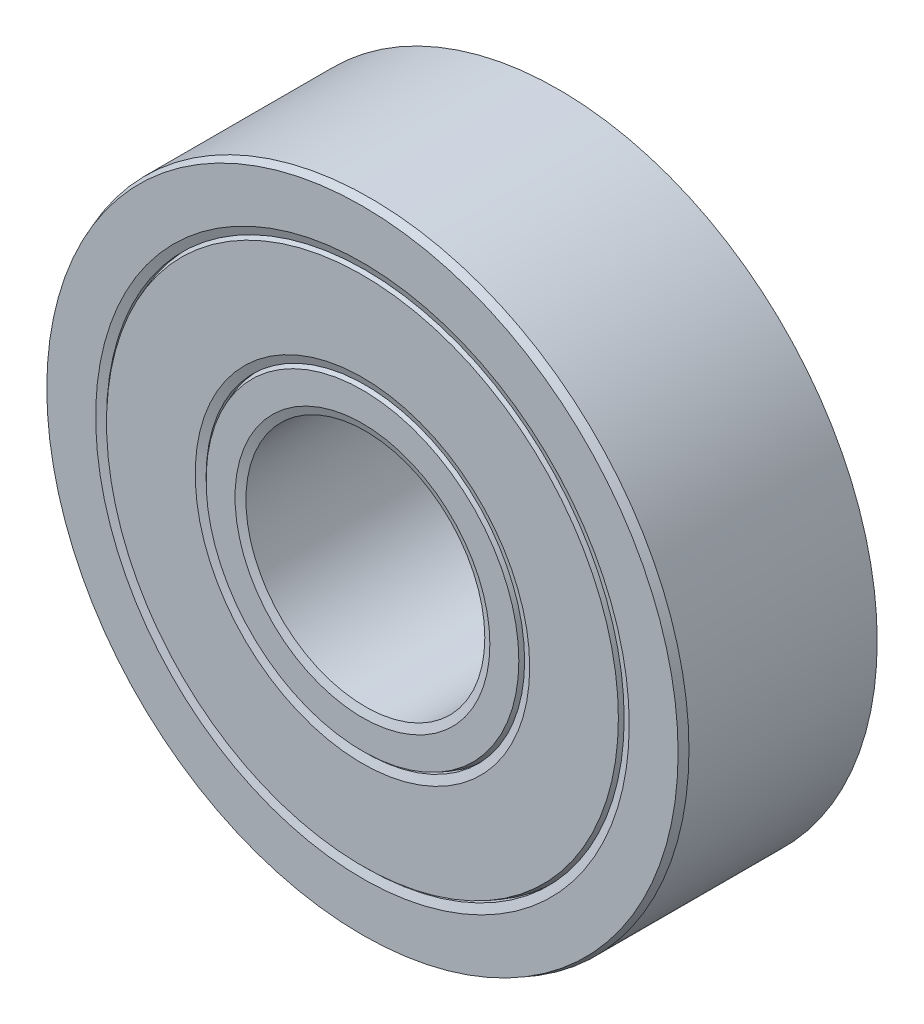
from build123d import *
from OCP.BRepFilletAPI import BRepFilletAPI_MakeChamfer

# Parameters (mm, degrees)
SKETCH1_R           = 4
SKETCH1_R_2         = 3
BOSS_EXTRUDE1_DEPTH = 5
SKETCH2_R           = 6.5
SKETCH2_R_2         = 4
BOSS_EXTRUDE2_DEPTH = 5
SKETCH3_R           = 8
SKETCH3_R_2         = 6.5
BOSS_EXTRUDE3_DEPTH = 5
CHAMFER1_SIZE       = 0.2
CHAMFER1_SIZE2      = 0.072794047
CHAMFER2_SIZE       = 0.2
CHAMFER2_SIZE2      = 0.072794047
CHAMFER3_SIZE       = 0.2
CHAMFER3_SIZE2      = 0.072794047


with BuildPart() as part:
    # Sketch1 → Boss-Extrude1 (new body)
    with BuildSketch(Plane.XY):
        Circle(SKETCH1_R)
        Circle(SKETCH1_R_2, mode=Mode.SUBTRACT)
    extrude(amount=BOSS_EXTRUDE1_DEPTH)

    # Chamfer1: one chamfer whose edges measure the first distance from different faces: ONE call of the kernel's chamfer builder (chamfer() names one face for all edges)
    chamfer1_edges_1 = [part.edges().sort_by_distance(p)[0] for p in [
        (-4, 0, 0),
    ]]
    chamfer1_side_1 = [part.faces().sort_by_distance(p)[0] for p in [
        (-3.886862915, 0, 0),
    ]]
    chamfer1_edges_2 = [part.edges().sort_by_distance(p)[0] for p in [
        (-4, 0, 5),
    ]]
    chamfer1_side_2 = [part.faces().sort_by_distance(p)[0] for p in [
        (-4, 0, 2.5),
    ]]
    chamfer1_edges_3 = [part.edges().sort_by_distance(p)[0] for p in [
        (-3, 0, 0),
    ]]
    chamfer1_side_3 = [part.faces().sort_by_distance(p)[0] for p in [
        (-3, 0, 2.5),
    ]]
    chamfer1_edges_4 = [part.edges().sort_by_distance(p)[0] for p in [
        (-3, 0, 5),
    ]]
    chamfer1_side_4 = [part.faces().sort_by_distance(p)[0] for p in [
        (-3.886862915, 0, 5),
    ]]
    chamfer1 = BRepFilletAPI_MakeChamfer(part.part.solid().wrapped)
    for e in chamfer1_edges_1:
        chamfer1.Add(CHAMFER1_SIZE, CHAMFER1_SIZE2, e.wrapped, chamfer1_side_1[0].wrapped)  # the first distance lies on this face
    for e in chamfer1_edges_2:
        chamfer1.Add(CHAMFER1_SIZE, CHAMFER1_SIZE2, e.wrapped, chamfer1_side_2[0].wrapped)  # the first distance lies on this face
    for e in chamfer1_edges_3:
        chamfer1.Add(CHAMFER1_SIZE, CHAMFER1_SIZE2, e.wrapped, chamfer1_side_3[0].wrapped)  # the first distance lies on this face
    for e in chamfer1_edges_4:
        chamfer1.Add(CHAMFER1_SIZE, CHAMFER1_SIZE2, e.wrapped, chamfer1_side_4[0].wrapped)  # the first distance lies on this face
    add(Compound.cast(chamfer1.Shape()), mode=Mode.REPLACE)


with BuildPart() as body_2:
    # Sketch2 → Boss-Extrude2 (new body)
    with BuildSketch(Plane.XY.offset(5)):
        Circle(SKETCH2_R)
        Circle(SKETCH2_R_2, mode=Mode.SUBTRACT)
    extrude(amount=-BOSS_EXTRUDE2_DEPTH)

    # Chamfer2: one chamfer whose edges measure the first distance from different faces: ONE call of the kernel's chamfer builder (chamfer() names one face for all edges)
    chamfer2_edges_1 = [body_2.edges().sort_by_distance(p)[0] for p in [
        (-6.5, 0, 5),
    ]]
    chamfer2_side_1 = [body_2.faces().sort_by_distance(p)[0] for p in [
        (-6.5, 0, 2.5),
    ]]
    chamfer2_edges_2 = [body_2.edges().sort_by_distance(p)[0] for p in [
        (-6.5, 0, 0),
    ]]
    chamfer2_side_2 = [body_2.faces().sort_by_distance(p)[0] for p in [
        (-6.316152237, 0, 0),
    ]]
    chamfer2_edges_3 = [body_2.edges().sort_by_distance(p)[0] for p in [
        (-4, 0, 0),
    ]]
    chamfer2_side_3 = [body_2.faces().sort_by_distance(p)[0] for p in [
        (-4, 0, 2.5),
    ]]
    chamfer2_edges_4 = [body_2.edges().sort_by_distance(p)[0] for p in [
        (-4, 0, 5),
    ]]
    chamfer2_side_4 = [body_2.faces().sort_by_distance(p)[0] for p in [
        (-6.316152237, 0, 5),
    ]]
    chamfer2 = BRepFilletAPI_MakeChamfer(body_2.part.solid().wrapped)
    for e in chamfer2_edges_1:
        chamfer2.Add(CHAMFER2_SIZE, CHAMFER2_SIZE2, e.wrapped, chamfer2_side_1[0].wrapped)  # the first distance lies on this face
    for e in chamfer2_edges_2:
        chamfer2.Add(CHAMFER2_SIZE, CHAMFER2_SIZE2, e.wrapped, chamfer2_side_2[0].wrapped)  # the first distance lies on this face
    for e in chamfer2_edges_3:
        chamfer2.Add(CHAMFER2_SIZE, CHAMFER2_SIZE2, e.wrapped, chamfer2_side_3[0].wrapped)  # the first distance lies on this face
    for e in chamfer2_edges_4:
        chamfer2.Add(CHAMFER2_SIZE, CHAMFER2_SIZE2, e.wrapped, chamfer2_side_4[0].wrapped)  # the first distance lies on this face
    add(Compound.cast(chamfer2.Shape()), mode=Mode.REPLACE)


with BuildPart() as body_3:
    # Sketch3 → Boss-Extrude3 (new body)
    with BuildSketch(Plane.XY.offset(5)):
        Circle(SKETCH3_R)
        Circle(SKETCH3_R_2, mode=Mode.SUBTRACT)
    extrude(amount=-BOSS_EXTRUDE3_DEPTH)

    # Chamfer3: one chamfer whose edges measure the first distance from different faces: ONE call of the kernel's chamfer builder (chamfer() names one face for all edges)
    chamfer3_edges_1 = [body_3.edges().sort_by_distance(p)[0] for p in [
        (-8, 0, 5),
    ]]
    chamfer3_side_1 = [body_3.faces().sort_by_distance(p)[0] for p in [
        (-8, 0, 2.5),
    ]]
    chamfer3_edges_2 = [body_3.edges().sort_by_distance(p)[0] for p in [
        (-8, 0, 0),
    ]]
    chamfer3_side_2 = [body_3.faces().sort_by_distance(p)[0] for p in [
        (-7.77372583, 0, 0),
    ]]
    chamfer3_edges_3 = [body_3.edges().sort_by_distance(p)[0] for p in [
        (-6.5, 0, 0),
    ]]
    chamfer3_side_3 = [body_3.faces().sort_by_distance(p)[0] for p in [
        (-6.5, 0, 2.5),
    ]]
    chamfer3_edges_4 = [body_3.edges().sort_by_distance(p)[0] for p in [
        (-6.5, 0, 5),
    ]]
    chamfer3_side_4 = [body_3.faces().sort_by_distance(p)[0] for p in [
        (-7.77372583, 0, 5),
    ]]
    chamfer3 = BRepFilletAPI_MakeChamfer(body_3.part.solid().wrapped)
    for e in chamfer3_edges_1:
        chamfer3.Add(CHAMFER3_SIZE, CHAMFER3_SIZE2, e.wrapped, chamfer3_side_1[0].wrapped)  # the first distance lies on this face
    for e in chamfer3_edges_2:
        chamfer3.Add(CHAMFER3_SIZE, CHAMFER3_SIZE2, e.wrapped, chamfer3_side_2[0].wrapped)  # the first distance lies on this face
    for e in chamfer3_edges_3:
        chamfer3.Add(CHAMFER3_SIZE, CHAMFER3_SIZE2, e.wrapped, chamfer3_side_3[0].wrapped)  # the first distance lies on this face
    for e in chamfer3_edges_4:
        chamfer3.Add(CHAMFER3_SIZE, CHAMFER3_SIZE2, e.wrapped, chamfer3_side_4[0].wrapped)  # the first distance lies on this face
    add(Compound.cast(chamfer3.Shape()), mode=Mode.REPLACE)


solid = Compound([part.part, body_2.part, body_3.part])
